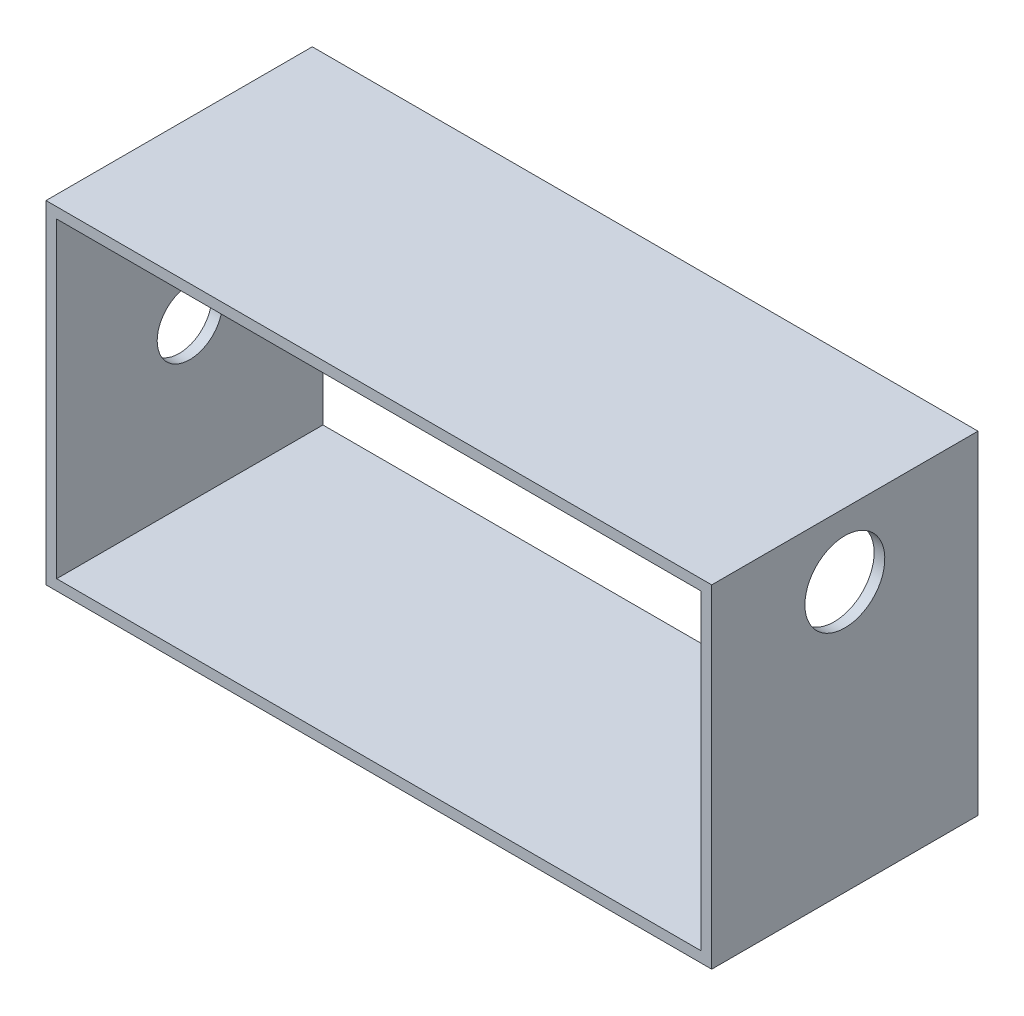
from build123d import *

# Parameters (mm, degrees)
SKIZZE1_W                       = 250
SKIZZE1_H                       = 125
SKIZZE1_W_2                     = 242
SKIZZE1_H_2                     = 117
AUFSATZ_LINEAR_AUSTRAGEN1_DEPTH = 100
SKIZZE2_R                       = 12.25
SCHNITT_LINEAR_AUSTRAGEN1_DEPTH = 10
SKIZZE3_R                       = 15
SCHNITT_LINEAR_AUSTRAGEN2_DEPTH = 10


with BuildPart() as part:
    # Skizze1 → Aufsatz-Linear austragen1 (new body)
    with BuildSketch(Plane.XY):
        with Locations((125, 62.5)):
            Rectangle(SKIZZE1_W, SKIZZE1_H)
        with Locations((125, 62.5)):
            Rectangle(SKIZZE1_W_2, SKIZZE1_H_2, mode=Mode.SUBTRACT)
    extrude(amount=AUFSATZ_LINEAR_AUSTRAGEN1_DEPTH)

    # Skizze2 → Schnitt-Linear austragen1 (cut)
    with BuildSketch(Plane.ZY):
        with Locations((50, 62.5)):
            Circle(SKIZZE2_R)
    extrude(amount=-SCHNITT_LINEAR_AUSTRAGEN1_DEPTH, mode=Mode.SUBTRACT)

    # Skizze3 → Schnitt-Linear austragen2 (cut)
    with BuildSketch(Plane.ZY.offset(-246)):
        with Locations(Location((50, 101, 0), (0, 0, 270))):
            Circle(SKIZZE3_R)
    extrude(amount=-SCHNITT_LINEAR_AUSTRAGEN2_DEPTH, mode=Mode.SUBTRACT)


solid = part.part
